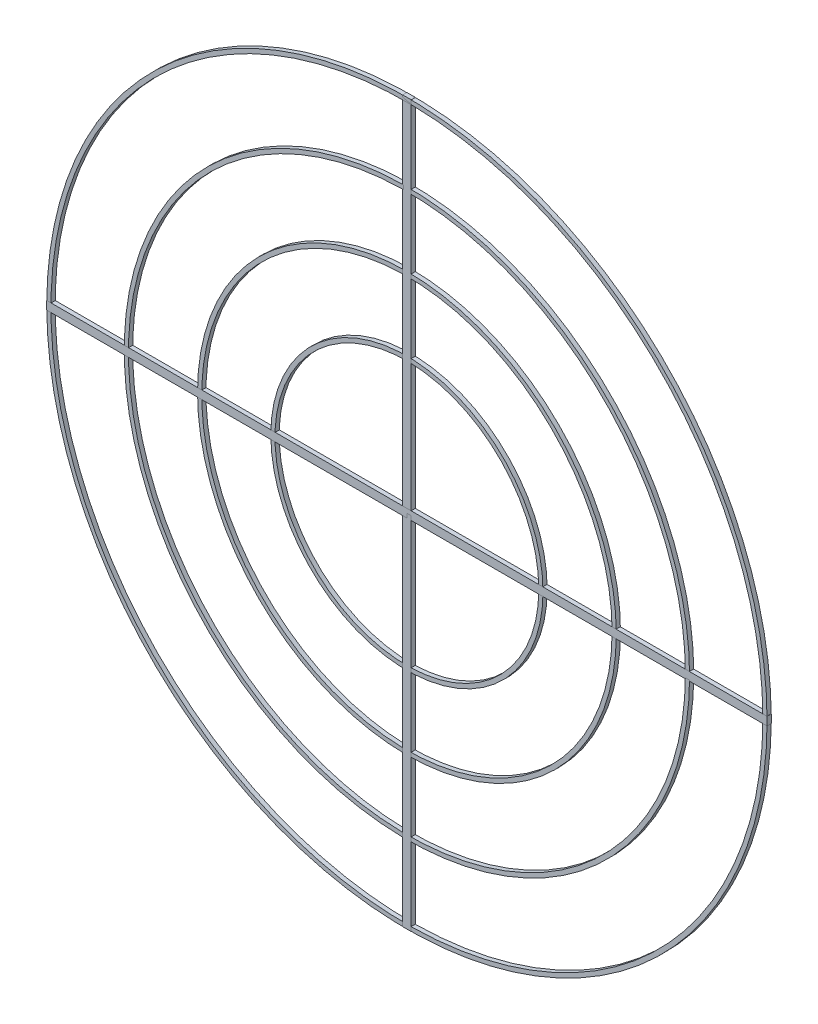
from build123d import *

# Parameters (mm, degrees)
GUARD_RING_ASSUMED_START        = 450
SKETCH1_R                       = 65
SKETCH1_R_2                     = 63
GUARD_RING_ASSUMED_DEPTH        = 2
BOSS_EXTRUDE2_START             = 450
SKETCH2_R                       = 100
SKETCH2_R_2                     = 98
BOSS_EXTRUDE2_DEPTH             = 2
BOSS_EXTRUDE3_START             = 450
SKETCH3_R                       = 135
SKETCH3_R_2                     = 133
BOSS_EXTRUDE3_DEPTH             = 2
BOSS_EXTRUDE4_START             = 450
SKETCH4_R                       = 172
SKETCH4_R_2                     = 170
BOSS_EXTRUDE4_DEPTH             = 2
GUARD_CROSSBAR_HORIZONTAL_START = 450
SKETCH5_W                       = 344
SKETCH5_H                       = 4
GUARD_CROSSBAR_HORIZONTAL_DEPTH = 2
GUARD_CROSSBAR_VERTICAL_START   = 450
SKETCH6_W                       = 4
SKETCH6_H                       = 344
GUARD_CROSSBAR_VERTICAL_DEPTH   = 2


with BuildPart() as part:
    # Sketch1 → Guard_ring_ASSUMED (new body)
    with BuildSketch(Plane.XY.offset(GUARD_RING_ASSUMED_START)):
        with Locations((0, 250)):
            Circle(SKETCH1_R)
        with Locations((0, 250)):
            Circle(SKETCH1_R_2, mode=Mode.SUBTRACT)
    extrude(amount=GUARD_RING_ASSUMED_DEPTH)


with BuildPart() as body_2:
    # Sketch2 → Boss-Extrude2 (new body)
    with BuildSketch(Plane.XY.offset(BOSS_EXTRUDE2_START)):
        with Locations((0, 250)):
            Circle(SKETCH2_R)
        with Locations((0, 250)):
            Circle(SKETCH2_R_2, mode=Mode.SUBTRACT)
    extrude(amount=BOSS_EXTRUDE2_DEPTH)


with BuildPart() as body_3:
    # Sketch3 → Boss-Extrude3 (new body)
    with BuildSketch(Plane.XY.offset(BOSS_EXTRUDE3_START)):
        with Locations((0, 250)):
            Circle(SKETCH3_R)
        with Locations((0, 250)):
            Circle(SKETCH3_R_2, mode=Mode.SUBTRACT)
    extrude(amount=BOSS_EXTRUDE3_DEPTH)


with BuildPart() as body_4:
    # Sketch4 → Boss-Extrude4 (new body)
    with BuildSketch(Plane.XY.offset(BOSS_EXTRUDE4_START)):
        with Locations((0, 250)):
            Circle(SKETCH4_R)
        with Locations((0, 250)):
            Circle(SKETCH4_R_2, mode=Mode.SUBTRACT)
    extrude(amount=BOSS_EXTRUDE4_DEPTH)


with BuildPart() as body_5:
    # Sketch5 → Guard_crossbar_horizontal (new body)
    with BuildSketch(Plane.XY.offset(GUARD_CROSSBAR_HORIZONTAL_START)):
        with Locations((0, 250)):
            Rectangle(SKETCH5_W, SKETCH5_H)
    extrude(amount=GUARD_CROSSBAR_HORIZONTAL_DEPTH)


with BuildPart() as body_6:
    # Sketch6 → Guard_crossbar_vertical (new body)
    with BuildSketch(Plane.XY.offset(GUARD_CROSSBAR_VERTICAL_START)):
        with Locations((0, 250)):
            Rectangle(SKETCH6_W, SKETCH6_H)
    extrude(amount=GUARD_CROSSBAR_VERTICAL_DEPTH)


solid = Compound([part.part, body_2.part, body_3.part, body_4.part, body_5.part, body_6.part])
